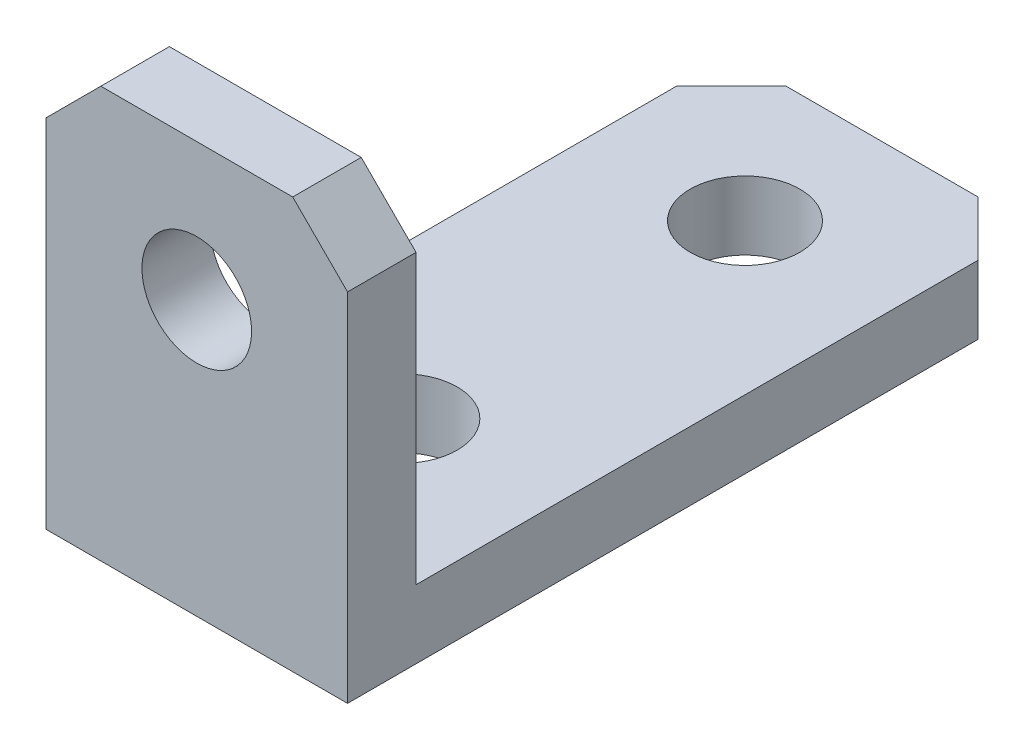
from build123d import *

# Parameters (mm, degrees)
SKETCH_1_W      = 22
SKETCH_1_H      = 50
SKETCH_1_R      = 4
EXTRUDE_1_DEPTH = 5
SKETCH_2_W      = 22
SKETCH_2_H      = 25
SKETCH_2_R      = 4
EXTRUDE_2_DEPTH = 5
CHAMFER_1_SIZE  = 4


with BuildPart() as part:
    # 草图1 → 凸台-拉伸1 (new body)
    with BuildSketch(Plane(origin=(0, 0, 0), x_dir=(1, 0, 0), z_dir=(0, 1, 0))):
        with Locations((-2.015873016, -3.888888889)):
            Rectangle(SKETCH_1_W, SKETCH_1_H)
        with Locations(Location((-2.015873016, 11.111111111, 0), (0, 0, 270))):
            Circle(SKETCH_1_R, mode=Mode.SUBTRACT)
        with Locations(Location((-2.015873016, -13.888888889, 0), (0, 0, 270))):
            Circle(SKETCH_1_R, mode=Mode.SUBTRACT)
    extrude(amount=EXTRUDE_1_DEPTH)

    # 草图2 → 凸台-拉伸2 (add)
    with BuildSketch(Plane.XY.offset(28.888888889)):
        with Locations((-2.015873016, 17.5)):
            Rectangle(SKETCH_2_W, SKETCH_2_H)
        with Locations((-2.015873016, 20)):
            Circle(SKETCH_2_R, mode=Mode.SUBTRACT)
    extrude(amount=-EXTRUDE_2_DEPTH)

    # 倒角1
    chamfer_1_edges = [part.edges().sort_by_distance(p)[0] for p in [
        (-13.015873016, 30, 26.388888889),
        (8.984126984, 30, 26.388888889),
        (-13.015873016, 2.5, -21.111111111),
        (8.984126984, 2.5, -21.111111111),
    ]]
    chamfer(chamfer_1_edges, length=CHAMFER_1_SIZE)


solid = part.part
